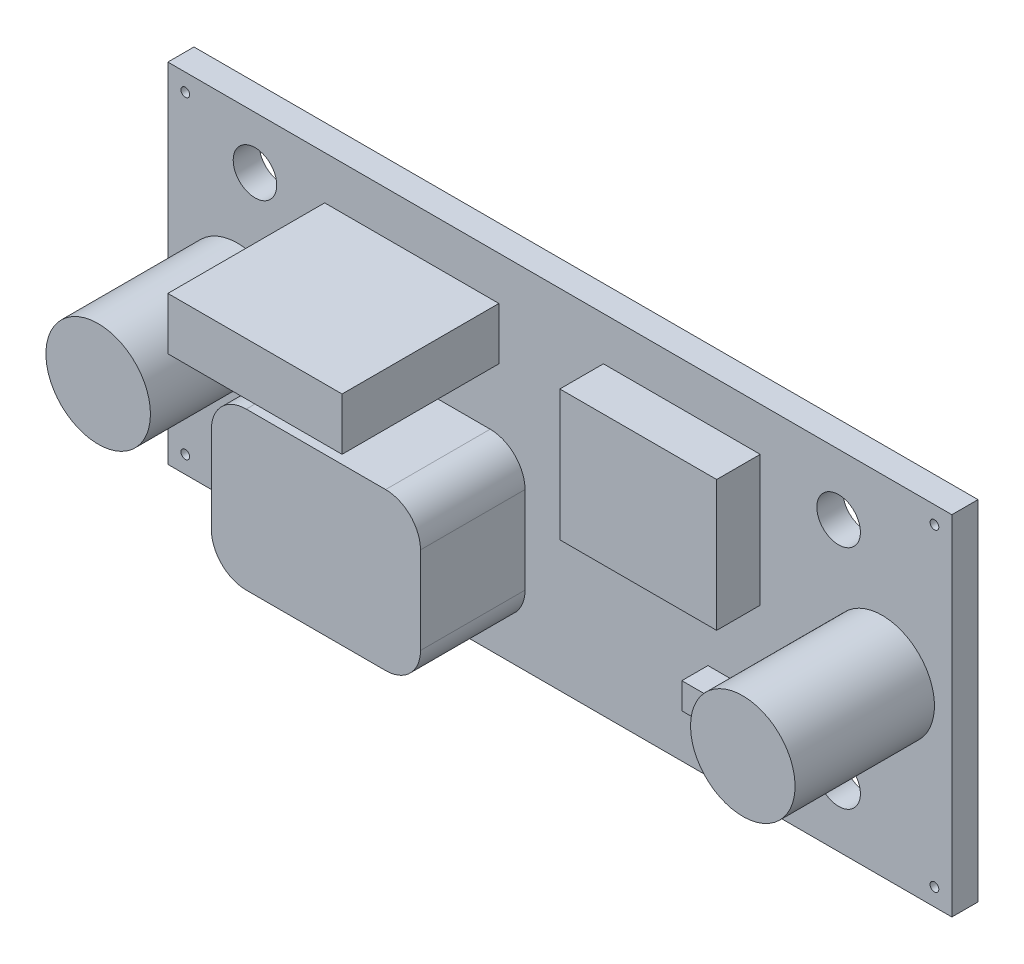
from build123d import *

# Parameters (mm, degrees)
SKETCH1_W           = 45
SKETCH1_H           = 20
BOSS_EXTRUDE1_DEPTH = 1.5
SKETCH2_R           = 3
BOSS_EXTRUDE3_DEPTH = 8
SKETCH3_W           = 10
SKETCH3_H           = 3
BOSS_EXTRUDE4_DEPTH = 9
BOSS_EXTRUDE5_DEPTH = 6
SKETCH6_W           = 9
SKETCH6_H           = 7.5
BOSS_EXTRUDE6_DEPTH = 2.5
SKETCH7_W           = 3
SKETCH7_H           = 1.5
BOSS_EXTRUDE7_DEPTH = 1.5
SKETCH9_R           = 1.25
CUT_EXTRUDE1_DEPTH  = 27.215453458
SKETCH10_R          = 1.25
CUT_EXTRUDE2_DEPTH  = 27.215453458
SKETCH12_R          = 0.25
CUT_EXTRUDE3_DEPTH  = 1.5


with BuildPart() as part:
    # Sketch1 → Boss-Extrude1 (new body)
    with BuildSketch(Plane.XY):
        Rectangle(SKETCH1_W, SKETCH1_H)
    extrude(amount=BOSS_EXTRUDE1_DEPTH)

    # Sketch2 → Boss-Extrude3 (add)
    with BuildSketch(Plane.XY.offset(1.5)):
        with Locations((-18.5, 0)):
            Circle(SKETCH2_R)
        with Locations(Location((18.5, 0, 0), (0, 0, 180))):
            Circle(SKETCH2_R)
    extrude(amount=BOSS_EXTRUDE3_DEPTH)

    # Sketch3 → Boss-Extrude4 (add)
    with BuildSketch(Plane.XY.offset(1.5)):
        with Locations((-8.5, 6)):
            Rectangle(SKETCH3_W, SKETCH3_H)
    extrude(amount=BOSS_EXTRUDE4_DEPTH)

    # Sketch5 → Boss-Extrude5 (add)
    with BuildSketch(Plane.XY.offset(1.5)):
        with BuildLine():
            Line((-12, 1), (-4, 1))
            ThreePointArc((-4, 1), (-2.585786438, 0.414213562), (-2, -1))
            Line((-2, -1), (-2, -6))
            ThreePointArc((-2, -6), (-2.585786438, -7.414213562), (-4, -8))
            Line((-4, -8), (-12, -8))
            ThreePointArc((-12, -8), (-13.414213562, -7.414213562), (-14, -6))
            Line((-14, -6), (-14, -1))
            ThreePointArc((-14, -1), (-13.414213562, 0.414213562), (-12, 1))
        make_face()
    extrude(amount=BOSS_EXTRUDE5_DEPTH)

    # Sketch6 → Boss-Extrude6 (add)
    with BuildSketch(Plane.XY.offset(1.5)):
        with Locations((7, 3.75)):
            Rectangle(SKETCH6_W, SKETCH6_H)
    extrude(amount=BOSS_EXTRUDE6_DEPTH)

    # Sketch7 → Boss-Extrude7 (add)
    with BuildSketch(Plane.XY.offset(1.5)):
        with Locations((10, -5.25)):
            Rectangle(SKETCH7_W, SKETCH7_H)
    extrude(amount=BOSS_EXTRUDE7_DEPTH)

    # Sketch9 → Cut-Extrude1 (cut, through all)
    with BuildSketch(Plane.XY.offset(1.5)):
        with Locations((-17.5, -7)):
            Circle(SKETCH9_R)
        with Locations(Location((-17.5, 7, 0), (0, 0, 180))):
            Circle(SKETCH9_R)
    extrude(amount=-CUT_EXTRUDE1_DEPTH, mode=Mode.SUBTRACT)

    # Sketch10 → Cut-Extrude2 (cut, through all)
    with BuildSketch(Plane.XY.offset(1.5)):
        with Locations((16, 6.5)):
            Circle(SKETCH10_R)
        with Locations(Location((16, -6.5, 0), (0, 0, 180))):
            Circle(SKETCH10_R)
    extrude(amount=-CUT_EXTRUDE2_DEPTH, mode=Mode.SUBTRACT)

    # Sketch12 → Cut-Extrude3 (cut)
    with BuildSketch(Plane.XY.offset(1.5)):
        with Locations((-21.5, 9)):
            Circle(SKETCH12_R)
        with Locations((21.5, 9)):
            Circle(SKETCH12_R)
        with Locations((21.5, -9)):
            Circle(SKETCH12_R)
        with Locations((-21.5, -9)):
            Circle(SKETCH12_R)
    extrude(amount=-CUT_EXTRUDE3_DEPTH, mode=Mode.SUBTRACT)


solid = part.part
